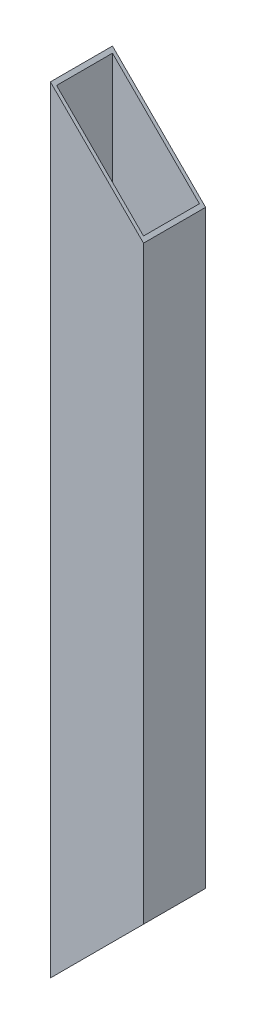
from build123d import *

# Parameters (mm, degrees)
IZIM1_W                     = 60
IZIM1_H                     = 40
IZIM1_W_2                   = 56
IZIM1_H_2                   = 36
Y_KSEKLIK_EKSTR_ZYON1_DEPTH = 500
KES_EKSTR_ZYON1_DEPTH       = 700


with BuildPart() as part:
    # Çizim1 → Yükseklik-Ekstrüzyon1 (new body)
    with BuildSketch(Plane(origin=(0, 0, 0), x_dir=(1, 0, 0), z_dir=(0, 1, 0))):
        with Locations((30, 20)):
            Rectangle(IZIM1_W, IZIM1_H)
        with Locations((30, 20)):
            Rectangle(IZIM1_W_2, IZIM1_H_2, mode=Mode.SUBTRACT)
    extrude(amount=Y_KSEKLIK_EKSTR_ZYON1_DEPTH)

    # Çizim2 → Kes-Ekstrüzyon1 (cut)
    with BuildSketch(Plane(origin=(0, 0, -40), x_dir=(-1, 0, 0), z_dir=(0, 0, -1))):
        Polygon((-60, 440), (0, 500), (-60, 500), align=None)
        Polygon((-60, 0), (0, 0), (-60, 60), align=None)
    extrude(amount=-KES_EKSTR_ZYON1_DEPTH, mode=Mode.SUBTRACT)


solid = part.part
